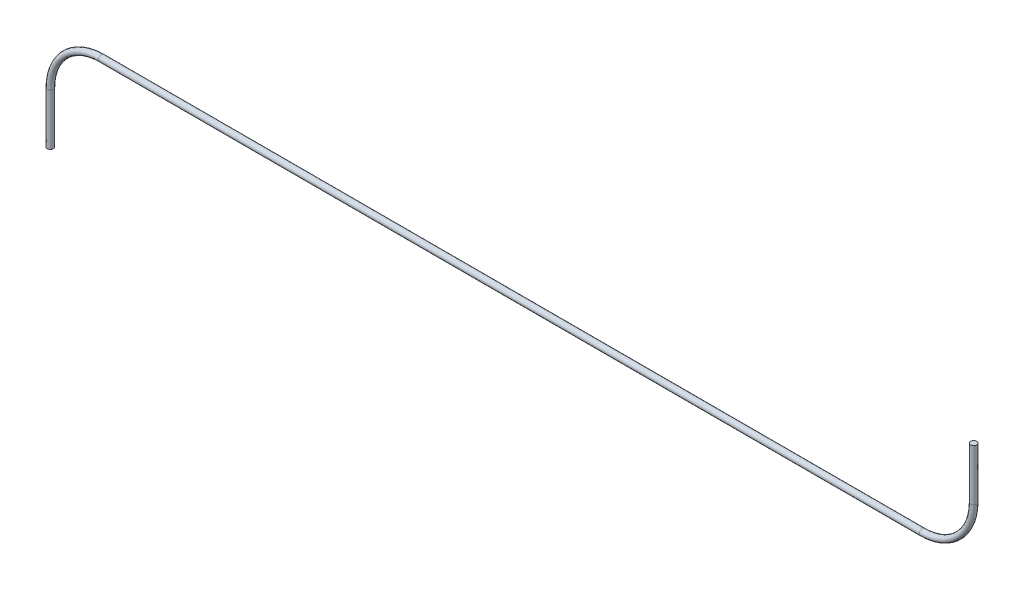
from build123d import *

# Parameters (mm, degrees)
SWEEP1_PROFILE_R = 0.6


with BuildPart() as part:
    # Sweep1: sweep along a path in Sketch1
    with BuildLine(Plane.XY) as sweep1_path:
        Line((0, 0), (0, 10))
        ThreePointArc((0, 10), (2.928932188, 17.071067812), (10, 20))
        Line((10, 20), (170, 20))
        ThreePointArc((170, 20), (177.071067812, 22.928932188), (180, 30))
        Line((180, 30), (180, 40))
    # Sweep1 profile (on start of the path) → Sweep1 (sweep)
    with BuildSketch(Plane.ZX):
        Circle(SWEEP1_PROFILE_R)
    sweep(path=sweep1_path.line)


solid = part.part
